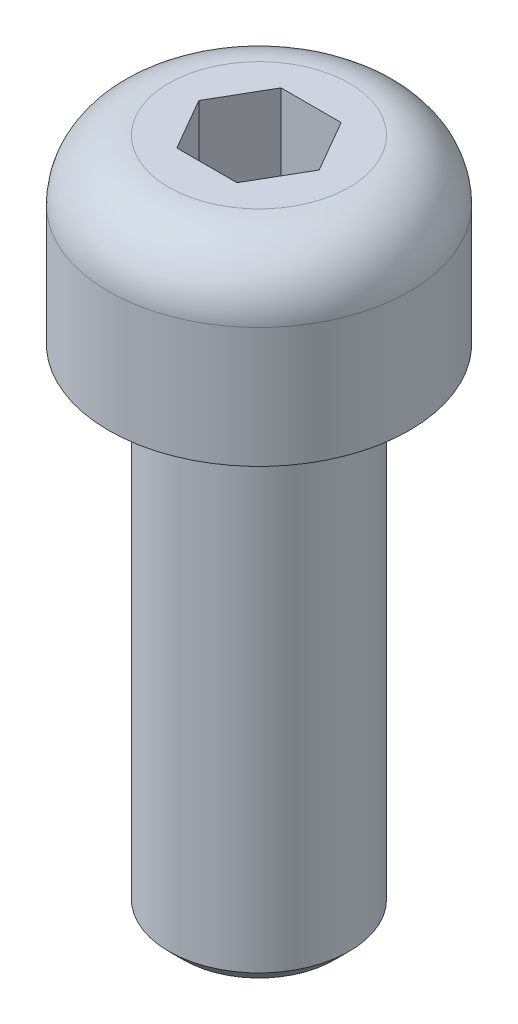
from build123d import *

# Parameters (mm, degrees)
SKETCH1_R           = 1.5
BOSS_EXTRUDE1_DEPTH = 8.25
SKETCH2_R           = 2.5
BOSS_EXTRUDE2_DEPTH = 3
FILLET1_R           = 1
CHAMFER1_SIZE       = 0.25
CUT_EXTRUDE1_DEPTH  = 2


with BuildPart() as part:
    # Sketch1 → Boss-Extrude1 (new body)
    with BuildSketch(Plane(origin=(0, 0, 0), x_dir=(1, 0, 0), z_dir=(0, 1, 0))):
        with Locations(Location((0, 0, 0), (0, 0, 270))):
            Circle(SKETCH1_R)
    extrude(amount=BOSS_EXTRUDE1_DEPTH)

    # Sketch2 → Boss-Extrude2 (add)
    with BuildSketch(Plane(origin=(0, 8.25, 0), x_dir=(1, 0, 0), z_dir=(0, 1, 0))):
        with Locations(Location((0, 0, 0), (0, 0, 270))):
            Circle(SKETCH2_R)
    extrude(amount=BOSS_EXTRUDE2_DEPTH)

    # Fillet1
    fillet1_edges = [part.edges().sort_by_distance(p)[0] for p in [
        (0, 11.25, -2.5),
    ]]
    fillet(fillet1_edges, radius=FILLET1_R)

    # Chamfer1
    chamfer1_edges = [part.edges().sort_by_distance(p)[0] for p in [
        (0, 0, -1.5),
    ]]
    chamfer(chamfer1_edges, length=CHAMFER1_SIZE)

    # Sketch3 → Cut-Extrude1 (cut)
    with BuildSketch(Plane(origin=(0, 11.25, 0), x_dir=(1, 0, 0), z_dir=(0, 1, 0))):
        Polygon((-1, 0), (-0.5, -0.866025404), (0.5, -0.866025404), (1, 0), (0.5, 0.866025404), (-0.5, 0.866025404), align=None)
    extrude(amount=-CUT_EXTRUDE1_DEPTH, mode=Mode.SUBTRACT)


solid = part.part
